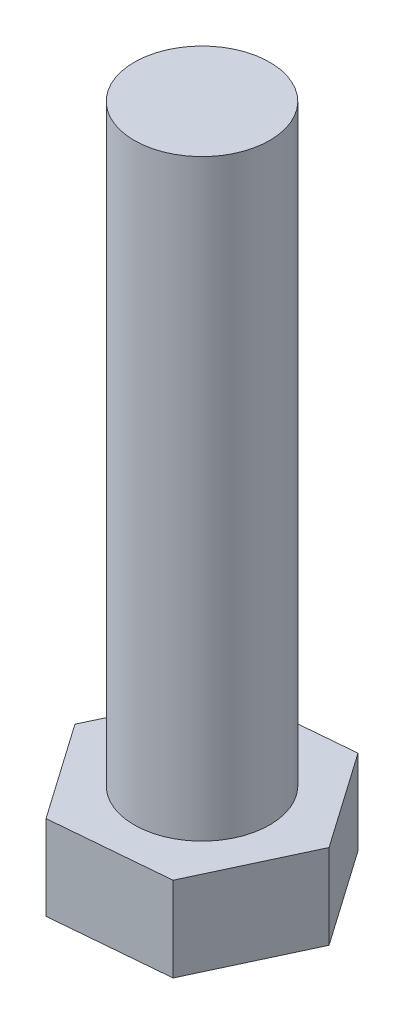
from build123d import *

# Parameters (mm, degrees)
BOSS_EXTRUDE1_DEPTH = 5
SKETCH2_R           = 4
BOSS_EXTRUDE2_DEPTH = 35


with BuildPart() as part:
    # Sketch1 → Boss-Extrude1 (new body)
    with BuildSketch(Plane(origin=(0, 0, 0), x_dir=(1, 0, 0), z_dir=(0, 1, 0))):
        Polygon((3.970106574, -5.677874056), (6.902236459, 0.599276121), (2.932129885, 6.277150177), (-3.970106574, 5.677874056), (-6.902236459, -0.599276121), (-2.932129885, -6.277150177), align=None)
    extrude(amount=BOSS_EXTRUDE1_DEPTH)

    # Sketch2 → Boss-Extrude2 (add)
    with BuildSketch(Plane(origin=(0, 5, 0), x_dir=(1, 0, 0), z_dir=(0, 1, 0))):
        with Locations(Location((0, 0, 0), (0, 0, 270))):
            Circle(SKETCH2_R)
    extrude(amount=BOSS_EXTRUDE2_DEPTH)


solid = part.part
